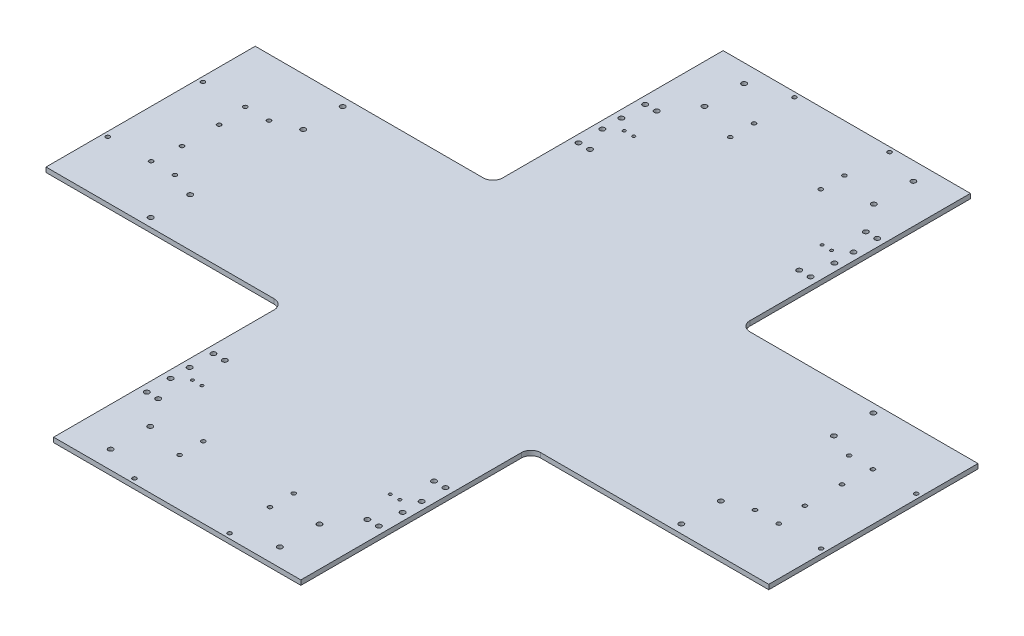
from build123d import *

# Parameters (mm, degrees)
BOSS_EXTRUDE1_DEPTH = 5
SKETCH2_R           = 2.125
CUT_EXTRUDE1_DEPTH  = 3
SKETCH4_R           = 2.6
SKETCH4_R_2         = 1.6
CUT_EXTRUDE3_DEPTH  = 10
SKETCH5_R           = 2.1
CUT_EXTRUDE4_DEPTH  = 10
FILLET1_R           = 10
SKETCH6_R           = 2.6
CUT_EXTRUDE5_DEPTH  = 10


with BuildPart() as part:
    # Sketch1 → Boss-Extrude1 (new body)
    with BuildSketch(Plane(origin=(0, 0, 0), x_dir=(1, 0, 0), z_dir=(0, 1, 0))):
        Polygon((130, 352), (-130, 352), (-130, 110), (-380, 110), (-380, -110), (-130, -110), (-130, -352), (130, -352), (130, -110), (380, -110), (380, 110), (130, 110), align=None)
    extrude(amount=BOSS_EXTRUDE1_DEPTH)

    # Sketch2 → Cut-Extrude1 (cut)
    with BuildSketch(Plane(origin=(0, 5, 0), x_dir=(1, 0, 0), z_dir=(0, 1, 0))):
        with Locations(Location((330, 49.5, 0), (0, 0, 270))):
            Circle(SKETCH2_R)
        with Locations(Location((305, 49.5, 0), (0, 0, 270))):
            Circle(SKETCH2_R)
        with Locations(Location((327.5, 19.5, 0), (0, 0, 270))):
            Circle(SKETCH2_R)
        with Locations(Location((327.5, -19.5, 0), (0, 0, 90))):
            Circle(SKETCH2_R)
        with Locations(Location((305, -49.5, 0), (0, 0, 90))):
            Circle(SKETCH2_R)
        with Locations(Location((330, -49.5, 0), (0, 0, 90))):
            Circle(SKETCH2_R)
        with Locations(Location((-330, -49.5, 0), (0, 0, 270))):
            Circle(SKETCH2_R)
        with Locations(Location((-305, -49.5, 0), (0, 0, 270))):
            Circle(SKETCH2_R)
        with Locations(Location((-327.5, -19.5, 0), (0, 0, 270))):
            Circle(SKETCH2_R)
        with Locations(Location((-327.5, 19.5, 0), (0, 0, 90))):
            Circle(SKETCH2_R)
        with Locations(Location((-305, 49.5, 0), (0, 0, 90))):
            Circle(SKETCH2_R)
        with Locations(Location((-330, 49.5, 0), (0, 0, 90))):
            Circle(SKETCH2_R)
        with Locations(Location((47.5, 302, 0), (0, 0, 270))):
            Circle(SKETCH2_R)
        with Locations(Location((47.5, 277, 0), (0, 0, 270))):
            Circle(SKETCH2_R)
        with Locations(Location((-47.5, 277, 0), (0, 0, 90))):
            Circle(SKETCH2_R)
        with Locations(Location((-47.5, 302, 0), (0, 0, 90))):
            Circle(SKETCH2_R)
        with Locations(Location((-47.5, -302, 0), (0, 0, 270))):
            Circle(SKETCH2_R)
        with Locations(Location((-47.5, -277, 0), (0, 0, 270))):
            Circle(SKETCH2_R)
        with Locations(Location((47.5, -277, 0), (0, 0, 90))):
            Circle(SKETCH2_R)
        with Locations(Location((47.5, -302, 0), (0, 0, 90))):
            Circle(SKETCH2_R)
    extrude(amount=-CUT_EXTRUDE1_DEPTH, mode=Mode.SUBTRACT)

    # Sketch4 → Cut-Extrude3 (cut)
    with BuildSketch(Plane(origin=(0, 5, 0), x_dir=(1, 0, 0), z_dir=(0, 1, 0))):
        with Locations(Location((-122, 192, 0), (0, 0, 270))):
            Circle(SKETCH4_R)
        with Locations(Location((-110, 192, 0), (0, 0, 270))):
            Circle(SKETCH4_R)
        with Locations(Location((-122, 217, 0), (0, 0, 270))):
            Circle(SKETCH4_R)
        with Locations(Location((-122, 237, 0), (0, 0, 270))):
            Circle(SKETCH4_R)
        with Locations(Location((-122, 262, 0), (0, 0, 270))):
            Circle(SKETCH4_R)
        with Locations(Location((-110, 262, 0), (0, 0, 270))):
            Circle(SKETCH4_R)
        with Locations(Location((110, 262, 0), (0, 0, 90))):
            Circle(SKETCH4_R)
        with Locations(Location((122, 262, 0), (0, 0, 90))):
            Circle(SKETCH4_R)
        with Locations(Location((122, 237, 0), (0, 0, 90))):
            Circle(SKETCH4_R)
        with Locations(Location((122, 217, 0), (0, 0, 90))):
            Circle(SKETCH4_R)
        with Locations(Location((110, 192, 0), (0, 0, 90))):
            Circle(SKETCH4_R)
        with Locations(Location((122, 192, 0), (0, 0, 90))):
            Circle(SKETCH4_R)
        with Locations(Location((122, -192, 0), (0, 0, 270))):
            Circle(SKETCH4_R)
        with Locations(Location((110, -192, 0), (0, 0, 270))):
            Circle(SKETCH4_R)
        with Locations(Location((122, -217, 0), (0, 0, 270))):
            Circle(SKETCH4_R)
        with Locations(Location((122, -237, 0), (0, 0, 270))):
            Circle(SKETCH4_R)
        with Locations(Location((122, -262, 0), (0, 0, 270))):
            Circle(SKETCH4_R)
        with Locations(Location((110, -262, 0), (0, 0, 270))):
            Circle(SKETCH4_R)
        with Locations(Location((-110, -262, 0), (0, 0, 90))):
            Circle(SKETCH4_R)
        with Locations(Location((-122, -262, 0), (0, 0, 90))):
            Circle(SKETCH4_R)
        with Locations(Location((-122, -237, 0), (0, 0, 90))):
            Circle(SKETCH4_R)
        with Locations(Location((-122, -217, 0), (0, 0, 90))):
            Circle(SKETCH4_R)
        with Locations(Location((-110, -192, 0), (0, 0, 90))):
            Circle(SKETCH4_R)
        with Locations(Location((-122, -192, 0), (0, 0, 90))):
            Circle(SKETCH4_R)
        with Locations(Location((109, -227, 0), (0, 0, 270))):
            Circle(SKETCH4_R_2)
        with Locations(Location((-109, -227, 0), (0, 0, 90))):
            Circle(SKETCH4_R_2)
        with Locations(Location((109, 227, 0), (0, 0, 90))):
            Circle(SKETCH4_R_2)
        with Locations(Location((-109, 227, 0), (0, 0, 270))):
            Circle(SKETCH4_R_2)
        with Locations(Location((99, -227, 0), (0, 0, 270))):
            Circle(SKETCH4_R_2)
        with Locations(Location((-99, -227, 0), (0, 0, 90))):
            Circle(SKETCH4_R_2)
        with Locations(Location((99, 227, 0), (0, 0, 90))):
            Circle(SKETCH4_R_2)
        with Locations(Location((-99, 227, 0), (0, 0, 270))):
            Circle(SKETCH4_R_2)
    extrude(amount=-CUT_EXTRUDE3_DEPTH, mode=Mode.SUBTRACT)

    # Sketch5 → Cut-Extrude4 (cut)
    with BuildSketch(Plane(origin=(0, 5, 0), x_dir=(1, 0, 0), z_dir=(0, 1, 0))):
        with Locations(Location((-50, 347, 0), (0, 0, 270))):
            Circle(SKETCH5_R)
        with Locations(Location((50, 347, 0), (0, 0, 270))):
            Circle(SKETCH5_R)
        with Locations(Location((50, -347, 0), (0, 0, 90))):
            Circle(SKETCH5_R)
        with Locations(Location((-50, -347, 0), (0, 0, 90))):
            Circle(SKETCH5_R)
        with Locations(Location((-375, 50, 0), (0, 0, 270))):
            Circle(SKETCH5_R)
        with Locations(Location((-375, -50, 0), (0, 0, 270))):
            Circle(SKETCH5_R)
        with Locations(Location((375, -50, 0), (0, 0, 90))):
            Circle(SKETCH5_R)
        with Locations(Location((375, 50, 0), (0, 0, 90))):
            Circle(SKETCH5_R)
    extrude(amount=-CUT_EXTRUDE4_DEPTH, mode=Mode.SUBTRACT)

    # Fillet1
    fillet1_edges = [part.edges().sort_by_distance(p)[0] for p in [
        (130, 2.5, -110),
        (130, 2.5, 110),
        (-130, 2.5, 110),
        (-130, 2.5, -110),
    ]]
    fillet(fillet1_edges, radius=FILLET1_R)

    # Sketch6 → Cut-Extrude5 (cut)
    with BuildSketch(Plane(origin=(0, 5, 0), x_dir=(1, 0, 0), z_dir=(0, 1, 0))):
        with Locations(Location((89, 333, 0), (0, 0, 270))):
            Circle(SKETCH6_R)
        with Locations(Location((89, 291.4, 0), (0, 0, 270))):
            Circle(SKETCH6_R)
        with Locations(Location((89, -291.4, 0), (0, 0, 90))):
            Circle(SKETCH6_R)
        with Locations(Location((89, -333, 0), (0, 0, 90))):
            Circle(SKETCH6_R)
        with Locations(Location((-89, -333, 0), (0, 0, 270))):
            Circle(SKETCH6_R)
        with Locations(Location((-89, -291.4, 0), (0, 0, 270))):
            Circle(SKETCH6_R)
        with Locations(Location((-89, 291.4, 0), (0, 0, 90))):
            Circle(SKETCH6_R)
        with Locations(Location((-89, 333, 0), (0, 0, 90))):
            Circle(SKETCH6_R)
        with Locations(Location((279, 101, 0), (0, 0, 270))):
            Circle(SKETCH6_R)
        with Locations(Location((279, 59.4, 0), (0, 0, 270))):
            Circle(SKETCH6_R)
        with Locations(Location((279, -59.4, 0), (0, 0, 90))):
            Circle(SKETCH6_R)
        with Locations(Location((279, -101, 0), (0, 0, 90))):
            Circle(SKETCH6_R)
        with Locations(Location((-279, -101, 0), (0, 0, 270))):
            Circle(SKETCH6_R)
        with Locations(Location((-279, -59.4, 0), (0, 0, 270))):
            Circle(SKETCH6_R)
        with Locations(Location((-279, 59.4, 0), (0, 0, 90))):
            Circle(SKETCH6_R)
        with Locations(Location((-279, 101, 0), (0, 0, 90))):
            Circle(SKETCH6_R)
    extrude(amount=-CUT_EXTRUDE5_DEPTH, mode=Mode.SUBTRACT)


solid = part.part
